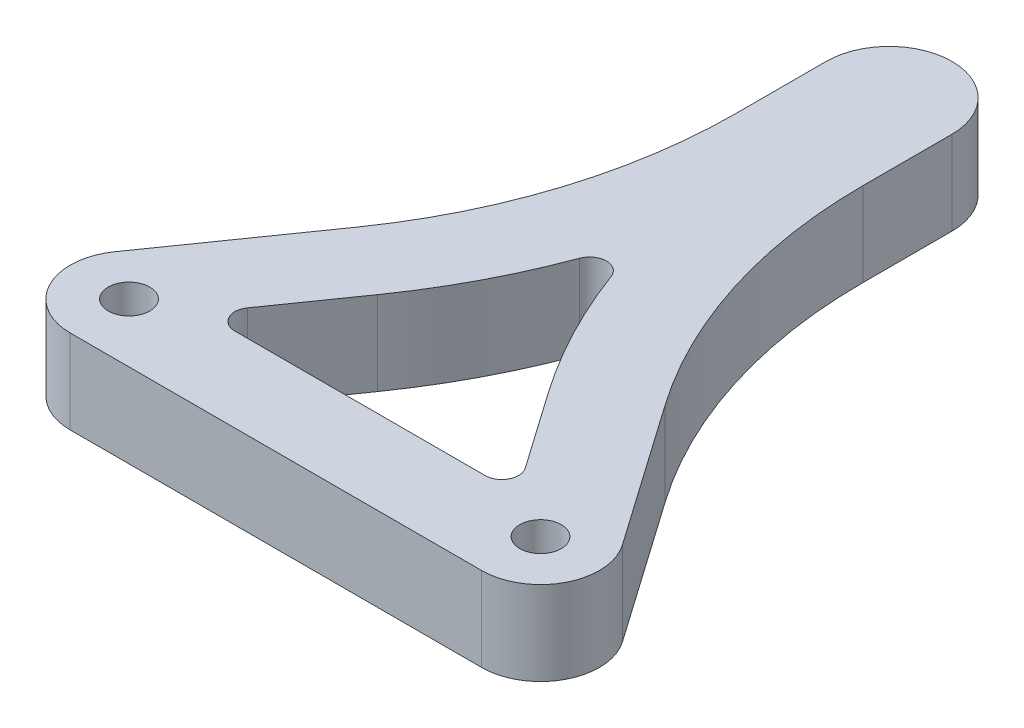
from build123d import *

# Parameters (mm, degrees)
SKETCH_1_R      = 2.475
EXTRUDE_1_DEPTH = 10
FILLET_1_R      = 2


with BuildPart() as part:
    # Эскиз1 → Бобышка-Вытянуть1 (new body)
    with BuildSketch(Plane(origin=(0, 0, 0), x_dir=(1, 0, 0), z_dir=(0, 1, 0))):
        with BuildLine():
            Line((-7.5, 66), (-7.5, 55.400571017))
            ThreePointArc((-7.5, 55.400571017), (-10.276982955, 37.358223046), (-18.350877343, 20.985984836))
            Line((-18.350877343, 20.985984836), (-30.23406431, 4.015035054))
            ThreePointArc((-30.23406431, 4.015035054), (-30.709075832, -3.232240293), (-24.5, -7))
            Line((-24.5, -7), (24.5, -7))
            ThreePointArc((24.5, -7), (30.709075832, -3.232240293), (30.23406431, 4.015035054))
            Line((30.23406431, 4.015035054), (18.350877343, 20.985984836))
            ThreePointArc((18.350877343, 20.985984836), (10.276982955, 37.358223046), (7.5, 55.400571017))
            Line((7.5, 55.400571017), (7.5, 66))
            ThreePointArc((7.5, 66), (0, 73.5), (-7.5, 66))
        make_face()
        with Locations(Location((-24.5, 0, 0), (0, 0, 270))):
            Circle(SKETCH_1_R, mode=Mode.SUBTRACT)
        with Locations(Location((24.5, 0, 0), (0, 0, 270))):
            Circle(SKETCH_1_R, mode=Mode.SUBTRACT)
        with BuildLine():
            Line((10.1593569, 15.250220472), (18.737053619, 3))
            Line((18.737053619, 3), (-18.737053619, 3))
            Line((-18.737053619, 3), (-10.1593569, 15.250220472))
            ThreePointArc((-10.1593569, 15.250220472), (-4.1514168, 25.618747591), (0, 36.860074799))
            ThreePointArc((0, 36.860074799), (4.1514168, 25.618747591), (10.1593569, 15.250220472))
        make_face(mode=Mode.SUBTRACT)
    extrude(amount=EXTRUDE_1_DEPTH)

    # Скругление1
    fillet_1_edges = [part.edges().sort_by_distance(p)[0] for p in [
        (0, 5, -36.860074799),
        (-18.737053619, 5, -3),
        (18.737053619, 5, -3),
    ]]
    fillet(fillet_1_edges, radius=FILLET_1_R)


solid = part.part
